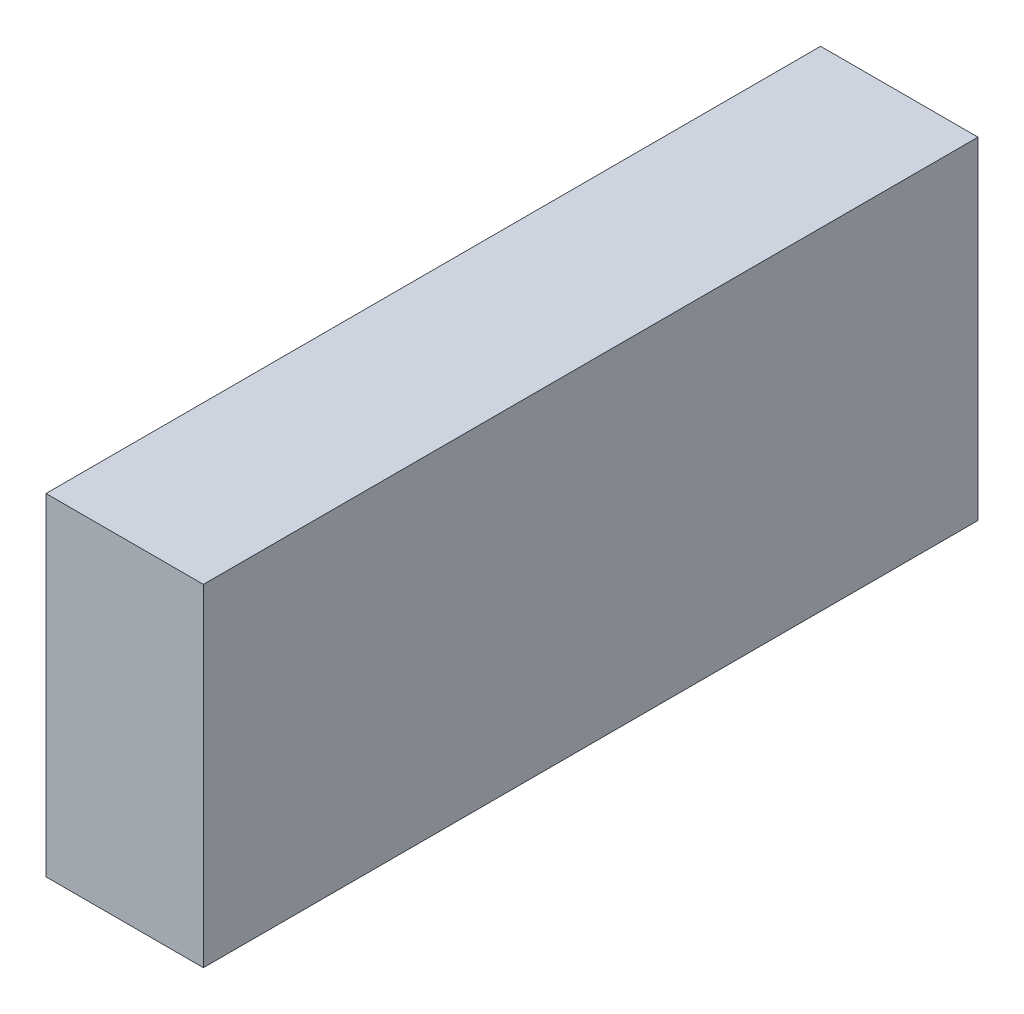
from build123d import *

# Parameters (mm, degrees)
CROQUIS1_W              = 10.16
CROQUIS1_H              = 21.43
SALIENTE_EXTRUIR1_DEPTH = 25


with BuildPart() as part:
    # Croquis1 → Saliente-Extruir1 (new, symmetric)
    with BuildSketch(Plane.XY):
        Rectangle(CROQUIS1_W, CROQUIS1_H)
    extrude(amount=SALIENTE_EXTRUIR1_DEPTH, both=True)


solid = part.part
